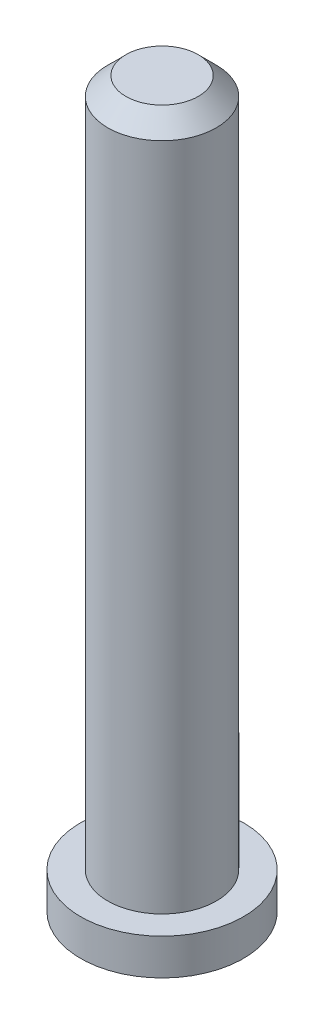
from build123d import *

# Parameters (mm, degrees)
SKETCH_1_R      = 1.5
EXTRUDE_1_DEPTH = 20
CHAMFER_1_SIZE  = 0.5
SKETCH_2_R      = 2.25
EXTRUDE_2_DEPTH = 1
SKETCH_3_R      = 0.3
EXTRUDE_3_DEPTH = 0.55


with BuildPart() as part:
    # Эскиз1 → Вытянуть1 (new body)
    with BuildSketch(Plane(origin=(0, 0, 0), x_dir=(1, 0, 0), z_dir=(0, 1, 0))):
        with Locations(Location((0, 0, 0), (0, 0, 270))):
            Circle(SKETCH_1_R)
    extrude(amount=EXTRUDE_1_DEPTH)

    # Фаска1
    chamfer_1_edges = [part.edges().sort_by_distance(p)[0] for p in [
        (0, 20, -1.5),
    ]]
    chamfer(chamfer_1_edges, length=CHAMFER_1_SIZE)

    # Эскиз2 → Вытянуть2 (add)
    with BuildSketch(Plane.XZ):
        with Locations(Location((0, 0, 0), (0, 0, 270))):
            Circle(SKETCH_2_R)
    extrude(amount=-EXTRUDE_2_DEPTH)

    # Эскиз3 → Вытянуть3 (add)
    with BuildSketch(Plane.XZ):
        with Locations(Location((0, 0, 0), (0, 0, 90))):
            Circle(SKETCH_3_R)
    extrude(amount=EXTRUDE_3_DEPTH)


solid = part.part
